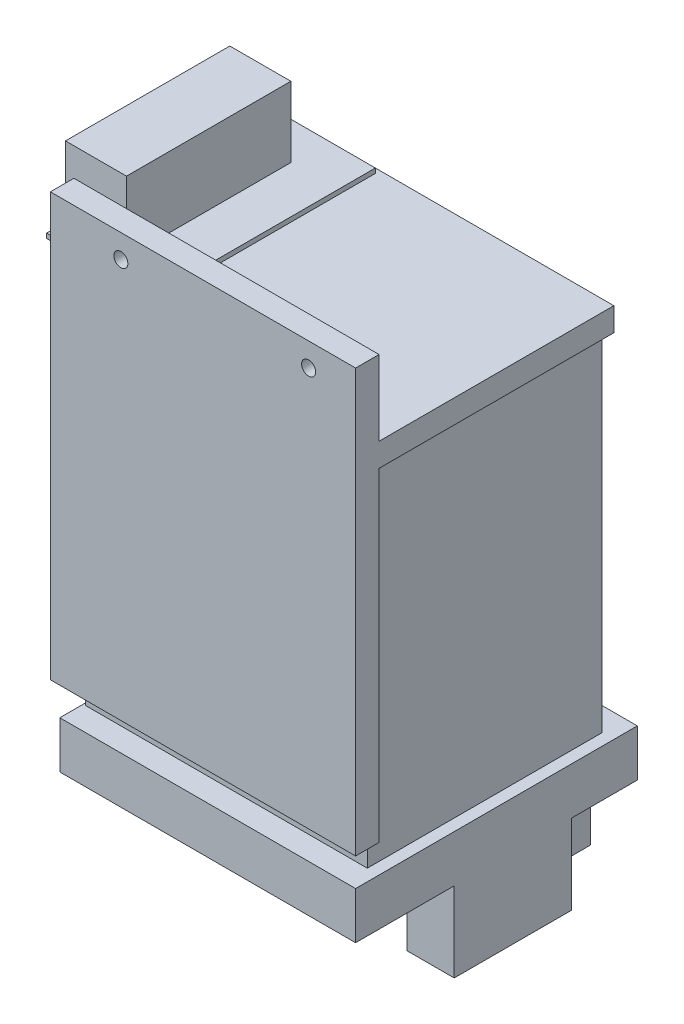
from build123d import *

# Parameters (mm, degrees)
SKETCH2_W           = 65
SKETCH2_H           = 90
SKETCH2_R           = 1.5
BOSS_EXTRUDE1_DEPTH = 5
SKETCH3_W           = 65
SKETCH3_H           = 5
BOSS_EXTRUDE2_DEPTH = 50
SKETCH4_W           = 23
SKETCH4_H           = 47
BOSS_EXTRUDE3_DEPTH = 1
SKETCH5_W           = 13
SKETCH5_H           = 35
BOSS_EXTRUDE4_DEPTH = 15
SKETCH6_W           = 60
SKETCH6_H           = 50
BOSS_EXTRUDE5_DEPTH = 75
SKETCH7_W           = 63
SKETCH7_H           = 60
BOSS_EXTRUDE6_DEPTH = 10
BOSS_EXTRUDE7_DEPTH = 17


with BuildPart() as part:
    # Sketch2 → Boss-Extrude1 (new body)
    with BuildSketch(Plane.XY):
        Rectangle(SKETCH2_W, SKETCH2_H)
        with Locations((-17.5, 40)):
            Circle(SKETCH2_R, mode=Mode.SUBTRACT)
        with Locations((22.5, 40)):
            Circle(SKETCH2_R, mode=Mode.SUBTRACT)
    extrude(amount=BOSS_EXTRUDE1_DEPTH)

    # Sketch3 → Boss-Extrude2 (add)
    with BuildSketch(Plane(origin=(0, 0, 0), x_dir=(-1, 0, 0), z_dir=(0, 0, -1))):
        with Locations((0, 26.5)):
            Rectangle(SKETCH3_W, SKETCH3_H)
    extrude(amount=BOSS_EXTRUDE2_DEPTH)

    # Sketch4 → Boss-Extrude3 (add)
    with BuildSketch(Plane(origin=(0, 29, 0), x_dir=(1, 0, 0), z_dir=(0, 1, 0))):
        with Locations((-28.787234074, 25.5)):
            Rectangle(SKETCH4_W, SKETCH4_H)
    extrude(amount=BOSS_EXTRUDE3_DEPTH)

    # Sketch5 → Boss-Extrude4 (add)
    with BuildSketch(Plane(origin=(0, 30, 0), x_dir=(1, 0, 0), z_dir=(0, 1, 0))):
        with Locations((-33.787234074, 23.5)):
            Rectangle(SKETCH5_W, SKETCH5_H)
    extrude(amount=BOSS_EXTRUDE4_DEPTH)

    # Sketch6 → Boss-Extrude5 (add)
    with BuildSketch(Plane.XZ.offset(-24)):
        with Locations((0, -25)):
            Rectangle(SKETCH6_W, SKETCH6_H)
    extrude(amount=BOSS_EXTRUDE5_DEPTH)

    # Sketch7 → Boss-Extrude6 (add)
    with BuildSketch(Plane.XZ.offset(51)):
        with Locations((1, -25)):
            Rectangle(SKETCH7_W, SKETCH7_H)
    extrude(amount=BOSS_EXTRUDE6_DEPTH)

    # Sketch8 → Boss-Extrude7 (add)
    with BuildSketch(Plane.XZ.offset(61)):
        Polygon((-7.5, -45), (22.5, -45), (22.5, -41), (22.5, -27), (-7.5, -27), align=None)
        Polygon((22.5, -55), (22.5, -45), (-7.5, -45), (-22.5, -45), (-22.5, -55), align=None)
        Polygon((22.5, -27), (22.5, -41), (32.5, -41), (32.5, -16), (22.5, -16), align=None)
    extrude(amount=BOSS_EXTRUDE7_DEPTH)


solid = part.part
